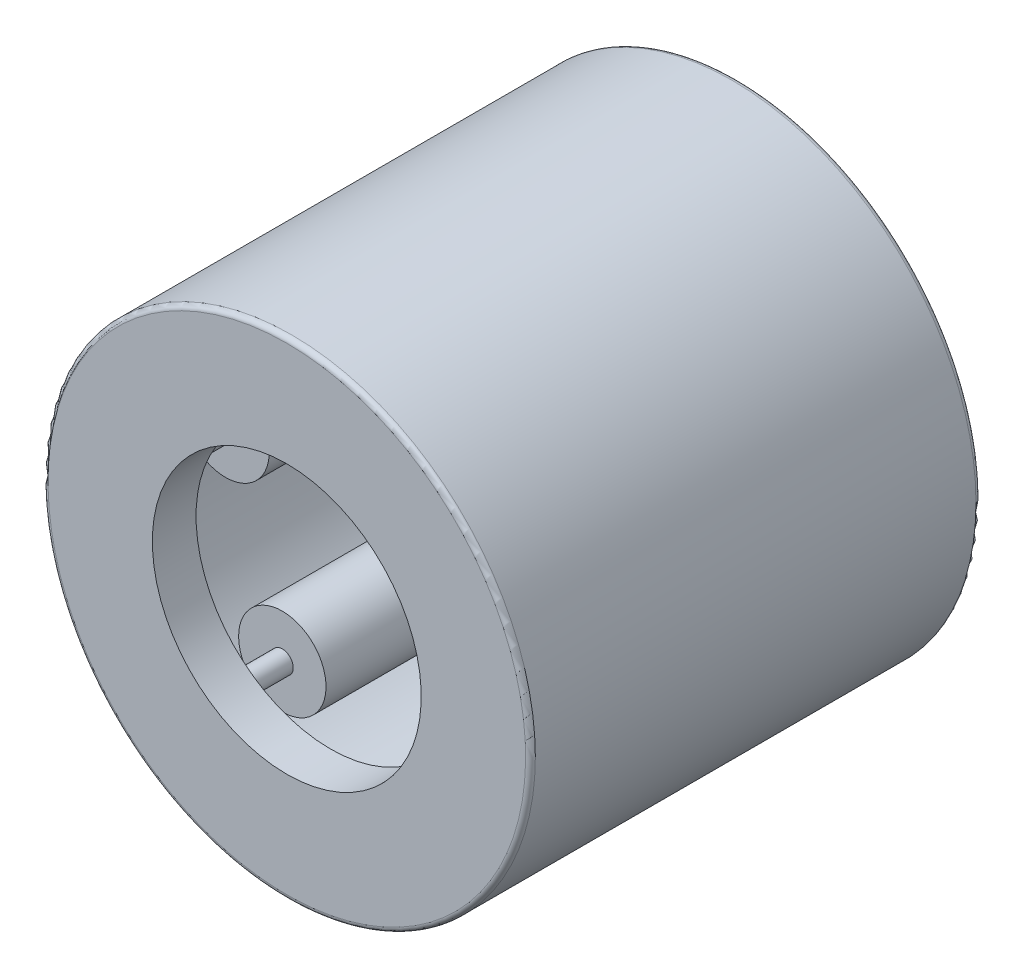
from build123d import *

# Parameters (mm, degrees)
SKETCH2_W         = 3.671333334
SKETCH2_H         = 0.436625
SKETCH3_W         = 4.835666666
SKETCH3_H         = 0.145541666
CIRPATTERN1_COUNT = 5
CIRPATTERN1_ANGLE = 288
FILLET1_R         = 0.06493


with BuildPart() as part:
    # Sketch1 → Revolve1 (revolve)
    with BuildSketch(Plane(origin=(0, 0, 0), x_dir=(0, 0, -1), z_dir=(1, 0, 0))):
        Polygon((-3, 3.2465), (3, 3.2465), (3, 1.791083333), (2.417833333, 1.791083333), (2.417833333, 2.664333333), (-2.417833333, 2.664333333), (-2.417833333, 1.791083333), (-3, 1.791083333), align=None)
    revolve(axis=Axis((0, 0, 3), (0, 0, -1)))

    # Fillet1
    fillet1_edges = [part.edges().sort_by_distance(p)[0] for p in [
        (0, -3.2465, -3),
        (0, -3.2465, 3),
    ]]
    fillet(fillet1_edges, radius=FILLET1_R)


with BuildPart() as body_2:
    # Sketch2 → Revolve2 (revolve)
    with BuildSketch(Plane(origin=(0, 0, 0), x_dir=(0, 0, -1), z_dir=(1, 0, 0))):
        with Locations((0, 2.446020833)):
            Rectangle(SKETCH2_W, SKETCH2_H)
    revolve(axis=Axis((0, 2.082166667, 1.835666667), (0, 0, -1)))


with BuildPart() as body_3:
    # Sketch3 → Revolve3 (revolve)
    with BuildSketch(Plane(origin=(0, 0, 0), x_dir=(0, 0, -1), z_dir=(1, 0, 0))):
        with Locations((0, 2.1549375)):
            Rectangle(SKETCH3_W, SKETCH3_H)
    revolve(axis=Axis((0, 2.082166667, 2.417833333), (0, 0, -1)))


with BuildPart() as cirpattern1_1:
    # CirPattern1: pattern copy
    add(body_3.part.rotate(Axis((0, 0, -3), (0, 0, 1)), 1 * CIRPATTERN1_ANGLE / (CIRPATTERN1_COUNT - 1)))


with BuildPart() as cirpattern1_2:
    # CirPattern1: pattern copy
    add(body_3.part.rotate(Axis((0, 0, -3), (0, 0, 1)), 2 * CIRPATTERN1_ANGLE / (CIRPATTERN1_COUNT - 1)))


with BuildPart() as cirpattern1_3:
    # CirPattern1: pattern copy
    add(body_3.part.rotate(Axis((0, 0, -3), (0, 0, 1)), 3 * CIRPATTERN1_ANGLE / (CIRPATTERN1_COUNT - 1)))


with BuildPart() as cirpattern1_4:
    # CirPattern1: pattern copy
    add(body_3.part.rotate(Axis((0, 0, -3), (0, 0, 1)), 4 * CIRPATTERN1_ANGLE / (CIRPATTERN1_COUNT - 1)))


with BuildPart() as cirpattern1_5:
    # CirPattern1: pattern copy
    add(body_2.part.rotate(Axis((0, 0, -3), (0, 0, 1)), 1 * CIRPATTERN1_ANGLE / (CIRPATTERN1_COUNT - 1)))


with BuildPart() as cirpattern1_6:
    # CirPattern1: pattern copy
    add(body_2.part.rotate(Axis((0, 0, -3), (0, 0, 1)), 2 * CIRPATTERN1_ANGLE / (CIRPATTERN1_COUNT - 1)))


with BuildPart() as cirpattern1_7:
    # CirPattern1: pattern copy
    add(body_2.part.rotate(Axis((0, 0, -3), (0, 0, 1)), 3 * CIRPATTERN1_ANGLE / (CIRPATTERN1_COUNT - 1)))


with BuildPart() as cirpattern1_8:
    # CirPattern1: pattern copy
    add(body_2.part.rotate(Axis((0, 0, -3), (0, 0, 1)), 4 * CIRPATTERN1_ANGLE / (CIRPATTERN1_COUNT - 1)))


solid = Compound([part.part, body_2.part, body_3.part, cirpattern1_1.part, cirpattern1_2.part, cirpattern1_3.part, cirpattern1_4.part, cirpattern1_5.part, cirpattern1_6.part, cirpattern1_7.part, cirpattern1_8.part])
